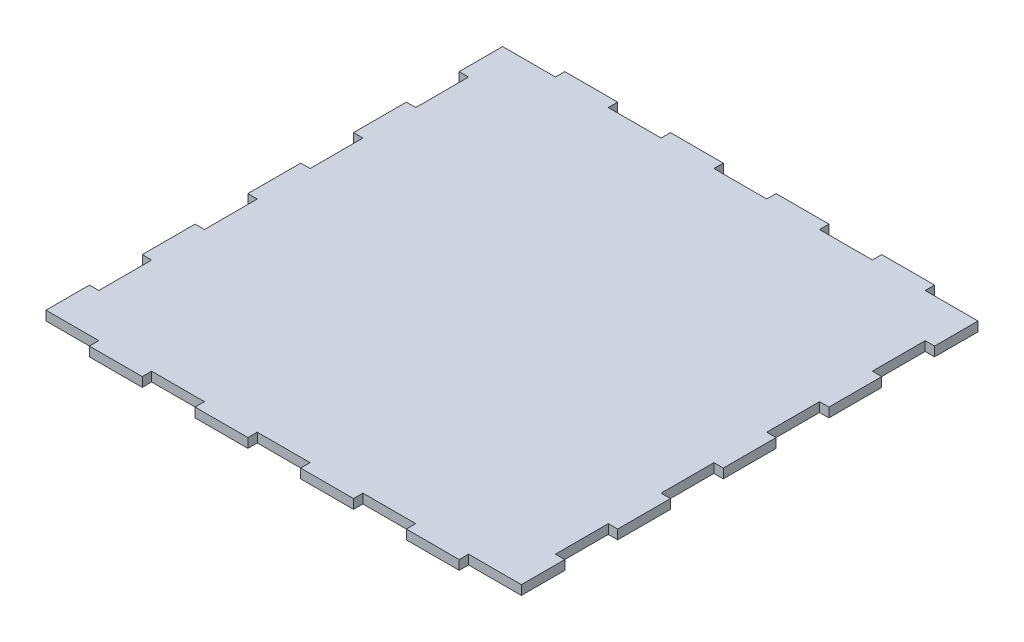
from build123d import *

# Parameters (mm, degrees)
BOSS_EXTRUDE1_DEPTH                      = 3
MIRROR1_AT_THE_SECOND_PLANE_COPY_1_DEPTH = 3


with BuildPart() as part:
    # Sketch1 → Boss-Extrude1 (new body)
    with BuildSketch(Plane(origin=(0, 0, 0), x_dir=(1, 0, 0), z_dir=(0, 1, 0))):
        Polygon((-76, -73), (-59.111111111, -73), (-59.111111111, -76), (-42.222222222, -76), (-42.222222222, -73), (-25.333333333, -73), (-25.333333333, -76), (-8.444444444, -76), (-8.444444444, -73), (0, -73), (0, 0), (-76, 0), (-76, -8.444444444), (-73, -8.444444444), (-73, -25.333333333), (-76, -25.333333333), (-76, -42.222222222), (-73, -42.222222222), (-73, -59.111111111), (-76, -59.111111111), align=None)
    boss_extrude1 = extrude(amount=BOSS_EXTRUDE1_DEPTH)



with BuildPart() as mirror1_1:
    # Mirror1: Boss-Extrude1 across plane
    add(boss_extrude1.mirror(Plane(origin=(0, 0, 0), x_dir=(0, 0, 1), z_dir=(1, 0, 0))))


with BuildPart() as part_1:
    add(part.part)

    add(mirror1_1.part)  # Mirror1 at the second plane merges Mirror1_1
    # Mirror1 at the second plane: Boss-Extrude1 across plane
    add(boss_extrude1.mirror(Plane.XY))

    # Mirror1 at the second plane copy 1 sketc → Mirror1 at the second plane copy 1 (add)
    with BuildSketch(Plane(origin=(0, 0, 0), x_dir=(-1, 0, 0), z_dir=(0, 1, 0))):
        Polygon((-76, -73), (-59.111111111, -73), (-59.111111111, -76), (-42.222222222, -76), (-42.222222222, -73), (-25.333333333, -73), (-25.333333333, -76), (-8.444444444, -76), (-8.444444444, -73), (0, -73), (0, 0), (-76, 0), (-76, -8.444444444), (-73, -8.444444444), (-73, -25.333333333), (-76, -25.333333333), (-76, -42.222222222), (-73, -42.222222222), (-73, -59.111111111), (-76, -59.111111111), align=None)
    extrude(amount=MIRROR1_AT_THE_SECOND_PLANE_COPY_1_DEPTH)


solid = part_1.part
